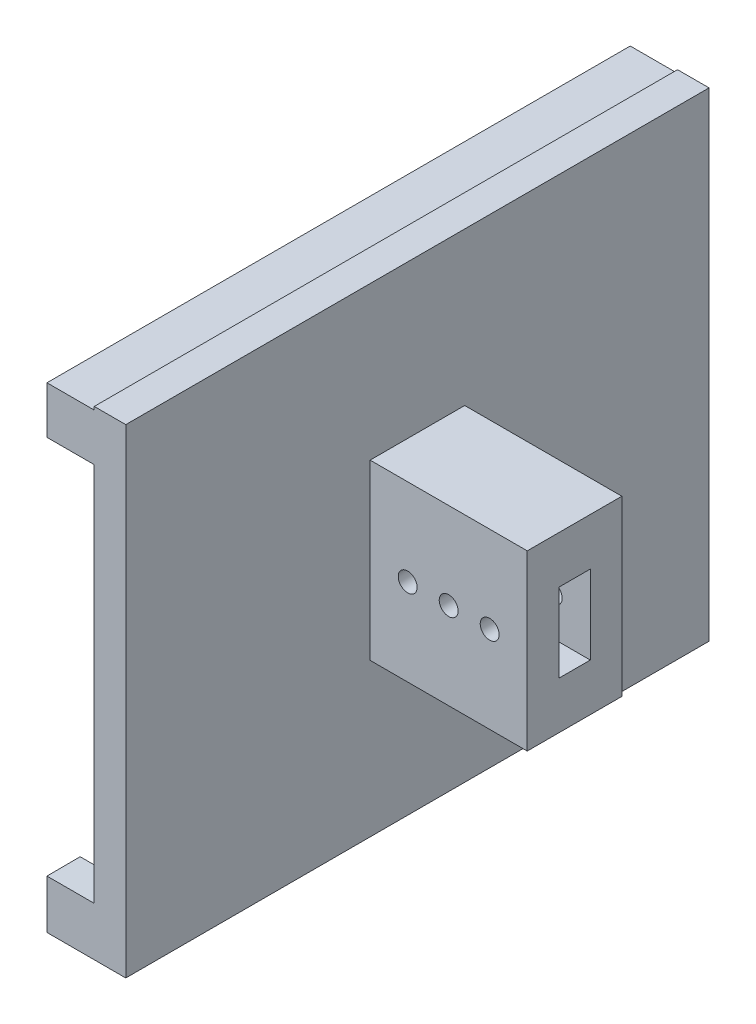
from build123d import *

# Parameters (mm, degrees)
SKETCH1_W                = 4.983520766
SKETCH1_H                = 2.5
SKETCH1_R                = 0.3
BOSS_EXTRUDE1_DEPTH      = 1
SKETCH4_W                = 8.75
SKETCH4_H                = 15.2
BOSS_EXTRUDE2_DEPTH      = 1
SKETCH4_3_R              = 0.5
BOSS_EXTRUDE3_DEPTH      = 1.5
BOSS_EXTRUDE4_DEPTH      = 1
BOSS_EXTRUDE4_DEPTH_BACK = 1
BOSS_EXTRUDE5_DEPTH      = 1.5
BOSS_EXTRUDE5_DEPTH_BACK = 1.5
SKETCH5_4_W              = 4.983520766
SKETCH5_4_H              = 1.5
SKETCH7_R                = 0.5
BOSS_EXTRUDE6_DEPTH      = 1.5


with BuildPart() as part:
    # Sketch1 → Boss-Extrude1 (new body)
    with BuildSketch(Plane.XY):
        with Locations((1.3, 0)):
            Rectangle(SKETCH1_W, SKETCH1_H)
        Circle(SKETCH1_R, mode=Mode.SUBTRACT)
        with Locations((1.3, 0)):
            Circle(SKETCH1_R, mode=Mode.SUBTRACT)
        with Locations((2.6, 0)):
            Circle(SKETCH1_R, mode=Mode.SUBTRACT)
    extrude(amount=-BOSS_EXTRUDE1_DEPTH)

    # Sketch4 → Boss-Extrude2 (add)
    with BuildSketch(Plane.ZY.offset(1.191760383)):
        with Locations((-4.375, 0)):
            Rectangle(SKETCH4_W, SKETCH4_H)
    extrude(amount=BOSS_EXTRUDE2_DEPTH)

    # Sketch4<3> → Boss-Extrude3 (add)
    with BuildSketch(Plane.ZY.offset(1.191760383)):
        with Locations((-7.2, -6)):
            Circle(SKETCH4_3_R)
        with Locations((-7.2, 6)):
            Circle(SKETCH4_3_R)
    extrude(amount=BOSS_EXTRUDE3_DEPTH)


with BuildPart() as body_2:
    # Mirror3: mirrored copy
    add(part.part.mirror(Plane.XY.offset(0.5)))


with BuildPart() as part_1:
    add(part.part)

    add(body_2.part)  # Boss-Extrude4 merges body 2
    # Sketch5 → Boss-Extrude4 (add, two sides: drawn at the far end of the back side and taken through both)
    with BuildSketch(Plane.XY.offset(0.5).offset(-BOSS_EXTRUDE4_DEPTH_BACK)):
        Polygon((-1.191760383, -7.6), (-1.191760383, -2.75), (-1.191760383, -1.25), (-1.191760383, 1.25), (-1.191760383, 2.75), (-1.191760383, 7.6), (-2.191760383, 7.6), (-2.191760383, -7.6), align=None)
    extrude(amount=BOSS_EXTRUDE4_DEPTH + BOSS_EXTRUDE4_DEPTH_BACK)

    # Sketch5<4> → Boss-Extrude5 (add, two sides: drawn at the far end of the back side and taken through both)
    with BuildSketch(Plane.XY.offset(0.5).offset(-BOSS_EXTRUDE5_DEPTH_BACK)):
        with Locations((1.3, -2)):
            Rectangle(SKETCH5_4_W, SKETCH5_4_H)
        with Locations((1.3, 2)):
            Rectangle(SKETCH5_4_W, SKETCH5_4_H)
    extrude(amount=BOSS_EXTRUDE5_DEPTH + BOSS_EXTRUDE5_DEPTH_BACK)

    # Sketch7 → Boss-Extrude6 (add)
    # profile 1 of 2: a face of its own
    with BuildSketch(Plane.ZY.offset(2.191760383)):
        with BuildLine():
            Line((-8.75, -7.5), (-7.2, -7.5))
            Line((-7.2, -7.5), (9.75, -7.6))
            Line((9.75, -7.6), (9.75, -6.05))
            Line((9.75, -6.05), (8.698032426, -6.044313689))
            ThreePointArc((8.698032426, -6.044313689), (8.197297337, -6.499992696), (7.701517624, -6.038927122))
            Line((7.701517624, -6.038927122), (0.5, -6))
            Line((0.5, -6), (0.5, -4.5))
            Line((0.5, -4.5), (-8.75, -4.5))
            Line((-8.75, -4.5), (-8.75, -7.5))
        make_face()
        with Locations((-7.2, -6)):
            Circle(SKETCH7_R, mode=Mode.SUBTRACT)
    # profile 2 of 2: a face of its own
    with BuildSketch(Plane.ZY.offset(2.191760383)):
        with BuildLine():
            Line((-8.75, 7.5), (-8.75, 4.5))
            Line((-8.75, 4.5), (0.5, 4.5))
            Line((0.5, 4.5), (0.5, 6))
            Line((0.5, 6), (7.7, 6))
            ThreePointArc((7.7, 6), (8.2, 6.5), (8.7, 6))
            Line((8.7, 6), (9.75, 6))
            Line((9.75, 6), (9.75, 7.5))
            Line((9.75, 7.5), (-8.75, 7.5))
        make_face()
        with Locations((-7.2, 6)):
            Circle(SKETCH7_R, mode=Mode.SUBTRACT)
    extrude(amount=BOSS_EXTRUDE6_DEPTH)


solid = part_1.part
